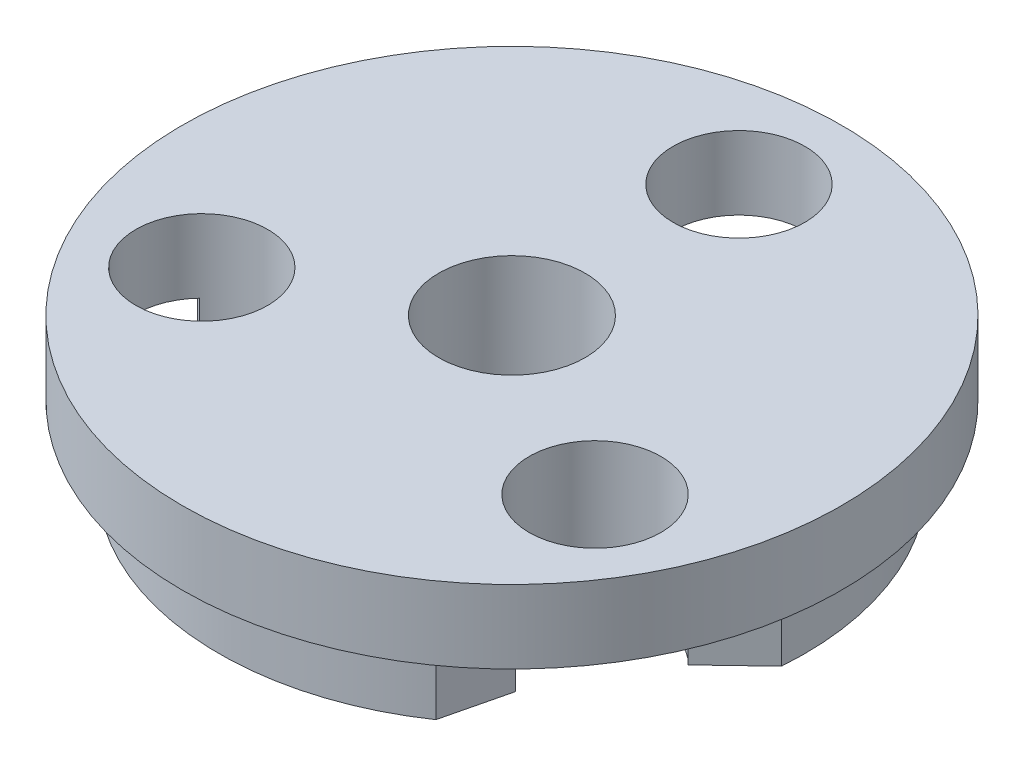
from build123d import *

# Parameters (mm, degrees)
SKETCH1_R           = 22.5
BOSS_EXTRUDE1_DEPTH = 3.5
SKETCH2_R           = 9
SKETCH2_R_2         = 9.000000000000007
CUT_EXTRUDE1_DEPTH  = 33.58066911528982
SKETCH7_R           = 5
CUT_EXTRUDE2_DEPTH  = 33.58066911528982
SKETCH8_R           = 5
BOSS_EXTRUDE2_DEPTH = 5
BOSS_EXTRUDE4_START = -5
BOSS_EXTRUDE4_DEPTH = 5
CUT_EXTRUDE3_DEPTH  = 7
BOSS_EXTRUDE8_START = 5
SKETCH15_R          = 22.5
SKETCH15_R_2        = 4.5
SKETCH15_R_3        = 5
BOSS_EXTRUDE8_DEPTH = 5


with BuildPart() as part:
    # Sketch1 → Boss-Extrude1 (new, symmetric)
    with BuildSketch(Plane(origin=(0, 0, 0), x_dir=(1, 0, 0), z_dir=(0, 1, 0))):
        with Locations(Location((0, 0, 0), (0, 0, 270))):
            Circle(SKETCH1_R)
    extrude(amount=BOSS_EXTRUDE1_DEPTH, both=True)

    # Sketch2 → Cut-Extrude1 (cut, through all)
    with BuildSketch(Plane(origin=(0, 3.5, 0), x_dir=(1, 0, 0), z_dir=(0, 1, 0))):
        with Locations((4.245e-14, 15.5)):
            Circle(SKETCH2_R)
        with Locations((13.42339375865983, -7.749999999999429)):
            Circle(SKETCH2_R_2)
        with Locations((-13.423393758657767, -7.7500000000005755)):
            Circle(SKETCH2_R)
    extrude(amount=-CUT_EXTRUDE1_DEPTH, mode=Mode.SUBTRACT)

    # Sketch7 → Cut-Extrude2 (cut, through all)
    with BuildSketch(Plane(origin=(0, 3.5, 0), x_dir=(1, 0, 0), z_dir=(0, 1, 0))):
        with Locations(Location((0, 0, 0), (0, 0, 270))):
            Circle(SKETCH7_R)
    extrude(amount=-CUT_EXTRUDE2_DEPTH, mode=Mode.SUBTRACT)

    # Sketch8 → Boss-Extrude2 (add)
    with BuildSketch(Plane.XZ.offset(3.5)):
        with BuildLine():
            ThreePointArc((8.634046628681784, -18.040322580645523), (16.921597628085173, -10.661122535323484), (20, -4.9e-15))
            ThreePointArc((20, 0), (19.985094686202057, 0.7720041344048885), (19.940400961646176, 1.5428575724221159))
            ThreePointArc((19.94040096164584, 1.542857572422255), (5.629165124599421, 3.250000000000214), (11.30635433296457, 16.497465008220495))
            ThreePointArc((11.306354332964553, 16.497465008220313), (1.07592e-12, 20), (-11.306354332962771, 16.497465008221535))
            ThreePointArc((-11.30635433296279, 16.497465008221706), (-5.629165124598033, 3.250000000000197), (-19.940400961645828, 1.5428575724255662))
            ThreePointArc((-19.940400961645913, 1.542857572425538), (-17.320508075688895, -9.999999999999787), (-8.634046628681693, -18.040322580645565))
            ThreePointArc((-8.634046628682263, -18.04032258064596), (1.954e-14, -6.5000000000000036), (8.634046628682352, -18.04032258064592))
        make_face()
        with Locations(Location((0, 0, 0), (0, 0, 90))):
            Circle(SKETCH8_R, mode=Mode.SUBTRACT)
    extrude(amount=BOSS_EXTRUDE2_DEPTH)

    # Sketch9 → Boss-Extrude4 (add)
    with BuildSketch(Plane.XZ.offset(8.5).offset(BOSS_EXTRUDE4_START)):
        with BuildLine():
            Line((-16.681897360151837, 4.646428786213113), (-19.940400961645906, 1.5428575724256501))
            ThreePointArc((-19.940400961645906, 1.5428575724256497), (-5.6291651245981145, 3.250000000000062), (-11.306354332962595, 16.497465008221653))
            Line((-11.306354332962595, 16.497465008221656), (-12.364874045810183, 12.123732504111118))
            ThreePointArc((-12.364874045810181, 12.123732504111118), (-9.52627944162794, 5.50000000000032), (-16.681897360151837, 4.646428786213113))
        make_face()
        with BuildLine():
            Line((12.3648740458121, 12.123732504109935), (11.306354332964363, 16.49746500822045))
            ThreePointArc((11.306354332964363, 16.49746500822045), (5.629165124599578, 3.249999999999936), (19.940400961646137, 1.5428575724225722))
            Line((19.94040096164614, 1.5428575724225757), (16.681897360152977, 4.646428786211002))
            ThreePointArc((16.681897360152977, 4.6464287862110005), (9.526279441629708, 5.499999999999686), (12.3648740458121, 12.123732504109935))
        make_face()
    extrude(amount=BOSS_EXTRUDE4_DEPTH)

    # Sketch10 → Cut-Extrude3 (cut)
    with BuildSketch(Plane(origin=(0, 3.5, 0), x_dir=(1, 0, 0), z_dir=(0, 1, 0))):
        with BuildLine():
            ThreePointArc((-6.73691741017109, 21.467741935483897), (2.481e-14, 6.5), (6.736917410171204, 21.46774193548386))
            ThreePointArc((6.736917410171204, 21.46774193548386), (19.485571585149323, 11.250000000000961), (21.96006858310362, -4.899529347333845))
            ThreePointArc((21.96006858310362, -4.899529347333845), (5.629165124599583, -3.24999999999993), (15.223151172932472, -16.56821258814737))
            ThreePointArc((15.223151172932472, -16.56821258814737), (6.8083e-13, -22.500000000000007), (-15.223151172931468, -16.568212588148292))
            ThreePointArc((-15.223151172931468, -16.568212588148292), (-5.629165124598114, -3.2500000000000657), (-21.960068583102636, -4.899529347338252))
            ThreePointArc((-21.960068583102636, -4.899529347338252), (-19.485571585150417, 11.249999999999057), (-6.73691741017109, 21.467741935483897))
        make_face()
    extrude(amount=-CUT_EXTRUDE3_DEPTH, mode=Mode.SUBTRACT)

    # Sketch15 → Boss-Extrude8 (add)
    # profile 1 of 2: a face of its own
    with BuildSketch(Plane(origin=(0, -3.5000000000000004, 0), x_dir=(1, 0, 0), z_dir=(0, 1, 0)).offset(BOSS_EXTRUDE8_START)):
        with Locations(Location((0, 0, 0), (0, 0, 270))):
            Circle(SKETCH15_R)
        with BuildLine():
            Line((-11.306354332962597, -16.49746500822166), (-12.364874045810184, -12.12373250411112))
            ThreePointArc((-12.364874045810184, -12.123732504111118), (-17.32050807568759, -10.000000000000831), (-16.681897360151837, -4.646428786213116))
            Line((-16.681897360151837, -4.646428786213116), (-19.9404009616459, -1.5428575724256433))
            ThreePointArc((-19.940400961645906, -1.5428575724256435), (-17.320508075689144, 9.99999999999936), (-8.63404662868249, 18.04032258064519))
            ThreePointArc((-8.634046628682489, 18.040322580645185), (1.865e-14, 6.499999999999998), (8.634046628682592, 18.040322580645135))
            ThreePointArc((8.634046628682588, 18.04032258064514), (17.320508075688394, 10.000000000000643), (19.94040096164614, -1.5428575724225746))
            Line((19.94040096164614, -1.5428575724225748), (16.681897360152977, -4.646428786211005))
            ThreePointArc((16.68189736015298, -4.646428786211002), (17.601507340572077, -6.078663140883227), (17.923393758659827, -7.749999999999429))
            ThreePointArc((17.923393758659827, -7.74999999999943), (16.206077830934763, -11.286476969231293), (12.3648740458121, -12.123732504109933))
            Line((12.3648740458121, -12.123732504109936), (11.306354332964357, -16.49746500822045))
            ThreePointArc((11.30635433296436, -16.49746500822045), (1.06937e-12, -20), (-11.306354332962597, -16.49746500822166))
        make_face(mode=Mode.SUBTRACT)
        with Locations(Location((4.245e-14, 15.5, 0), (0, 0, 270))):
            Circle(SKETCH15_R_2, mode=Mode.SUBTRACT)
    # profile 2 of 2: a face of its own
    with BuildSketch(Plane(origin=(0, -3.5000000000000004, 0), x_dir=(1, 0, 0), z_dir=(0, 1, 0)).offset(BOSS_EXTRUDE8_START)):
        with BuildLine():
            Line((-19.9404009616459, -1.5428575724256433), (-16.681897360151837, -4.646428786213116))
            ThreePointArc((-16.681897360151837, -4.646428786213116), (-9.526279441627942, -5.5000000000003215), (-12.364874045810184, -12.12373250411112))
            Line((-12.364874045810184, -12.12373250411112), (-11.306354332962597, -16.49746500822166))
            ThreePointArc((-11.306354332962597, -16.49746500822166), (1.06704e-12, -20.000000000000004), (11.306354332964357, -16.49746500822045))
            Line((11.306354332964357, -16.49746500822045), (12.3648740458121, -12.123732504109936))
            ThreePointArc((12.3648740458121, -12.123732504109936), (9.526279441629708, -5.499999999999686), (16.681897360152977, -4.646428786211005))
            Line((16.681897360152977, -4.646428786211005), (19.94040096164614, -1.5428575724225746))
            ThreePointArc((19.94040096164614, -1.5428575724225746), (17.3205080756884, 10.000000000000643), (8.634046628682588, 18.04032258064514))
            ThreePointArc((8.634046628682588, 18.04032258064514), (1.902e-14, 6.5), (-8.63404662868249, 18.040322580645185))
            ThreePointArc((-8.63404662868249, 18.040322580645185), (-17.320508075689144, 9.99999999999936), (-19.9404009616459, -1.5428575724256433))
        make_face()
        with Locations(Location((0, 0, 0), (0, 0, 270))):
            Circle(SKETCH15_R_3, mode=Mode.SUBTRACT)
    extrude(amount=-BOSS_EXTRUDE8_DEPTH)


solid = part.part
